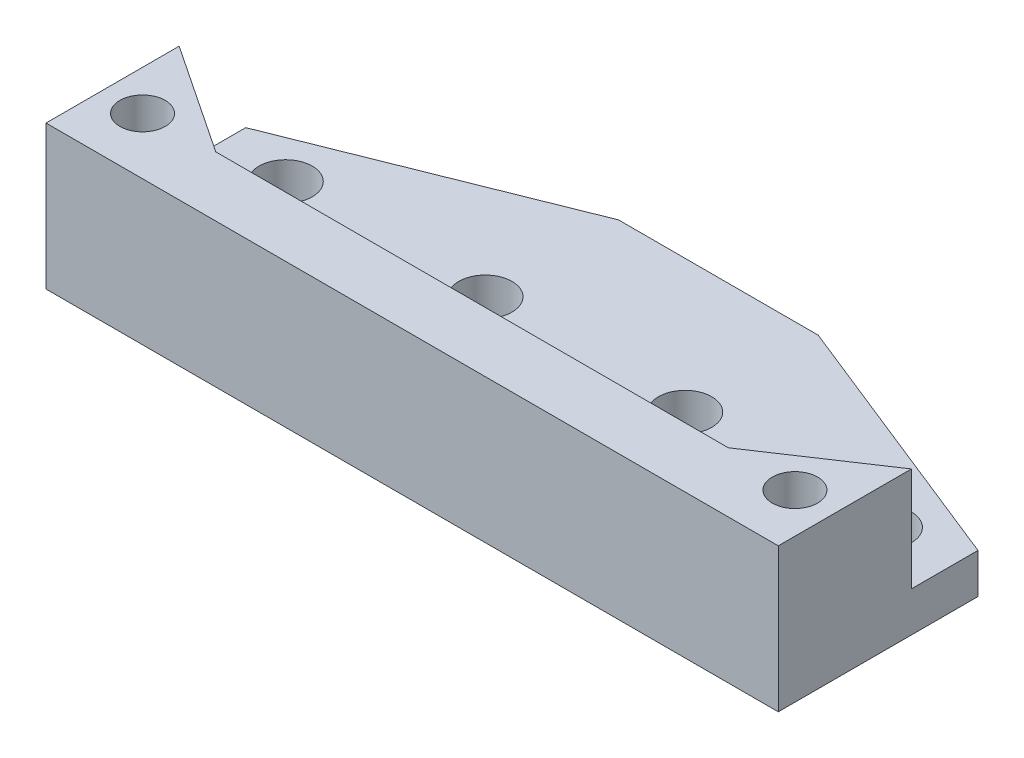
from build123d import *

# Parameters (mm, degrees)
SKETCH2_R           = 2
BOSS_EXTRUDE1_DEPTH = 3
BOSS_EXTRUDE2_DEPTH = 7.8
SKETCH4_R           = 1.7
CUT_EXTRUDE1_DEPTH  = 61.585806919


with BuildPart() as part:
    # Sketch2 → Boss-Extrude1 (new body)
    with BuildSketch(Plane(origin=(0, 0, 0), x_dir=(1, 0, 0), z_dir=(0, 1, 0))):
        Polygon((0, 0), (0, 15), (20, 23), (35, 23), (55, 15), (55, 0), align=None)
        with Locations(Location((5, 13, 0), (0, 0, 270))):
            Circle(SKETCH2_R, mode=Mode.SUBTRACT)
        with Locations(Location((20, 13, 0), (0, 0, 270))):
            Circle(SKETCH2_R, mode=Mode.SUBTRACT)
        with Locations(Location((35, 13, 0), (0, 0, 270))):
            Circle(SKETCH2_R, mode=Mode.SUBTRACT)
        with Locations(Location((50, 13, 0), (0, 0, 270))):
            Circle(SKETCH2_R, mode=Mode.SUBTRACT)
    extrude(amount=BOSS_EXTRUDE1_DEPTH)

    # Sketch3 → Boss-Extrude2 (add)
    with BuildSketch(Plane(origin=(0, 3, 0), x_dir=(1, 0, 0), z_dir=(0, 1, 0))):
        Polygon((0, 10), (0, 0), (15, 0), (8.25, 4.5), align=None)
        Polygon((8.25, 4.5), (15, 0), (40, 0), (46.75, 4.5), align=None)
        Polygon((46.75, 4.5), (40, 0), (55, 0), (55, 10), align=None)
    extrude(amount=BOSS_EXTRUDE2_DEPTH)

    # Sketch4 → Cut-Extrude1 (cut, through all)
    with BuildSketch(Plane(origin=(0, 10.8, 0), x_dir=(1, 0, 0), z_dir=(0, 1, 0))):
        with Locations(Location((3, 4.25, 0), (0, 0, 270))):
            Circle(SKETCH4_R)
        with Locations(Location((52, 4.25, 0), (0, 0, 270))):
            Circle(SKETCH4_R)
    extrude(amount=-CUT_EXTRUDE1_DEPTH, mode=Mode.SUBTRACT)


solid = part.part
